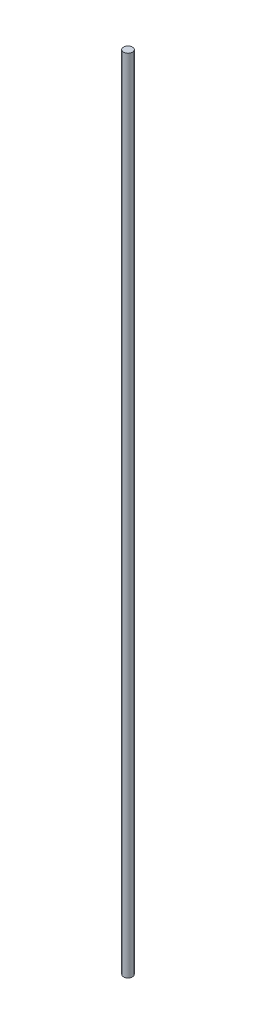
from build123d import *

# Parameters (mm, degrees)
SKETCH4_R           = 5.08
BOSS_EXTRUDE1_DEPTH = 914.4


with BuildPart() as part:
    # Sketch4 → Boss-Extrude1 (new body)
    with BuildSketch(Plane(origin=(0, 0, 0), x_dir=(1, 0, 0), z_dir=(0, 1, 0))):
        with Locations(Location((0, 0, 0), (0, 0, 270))):
            Circle(SKETCH4_R)
    extrude(amount=BOSS_EXTRUDE1_DEPTH)


solid = part.part
